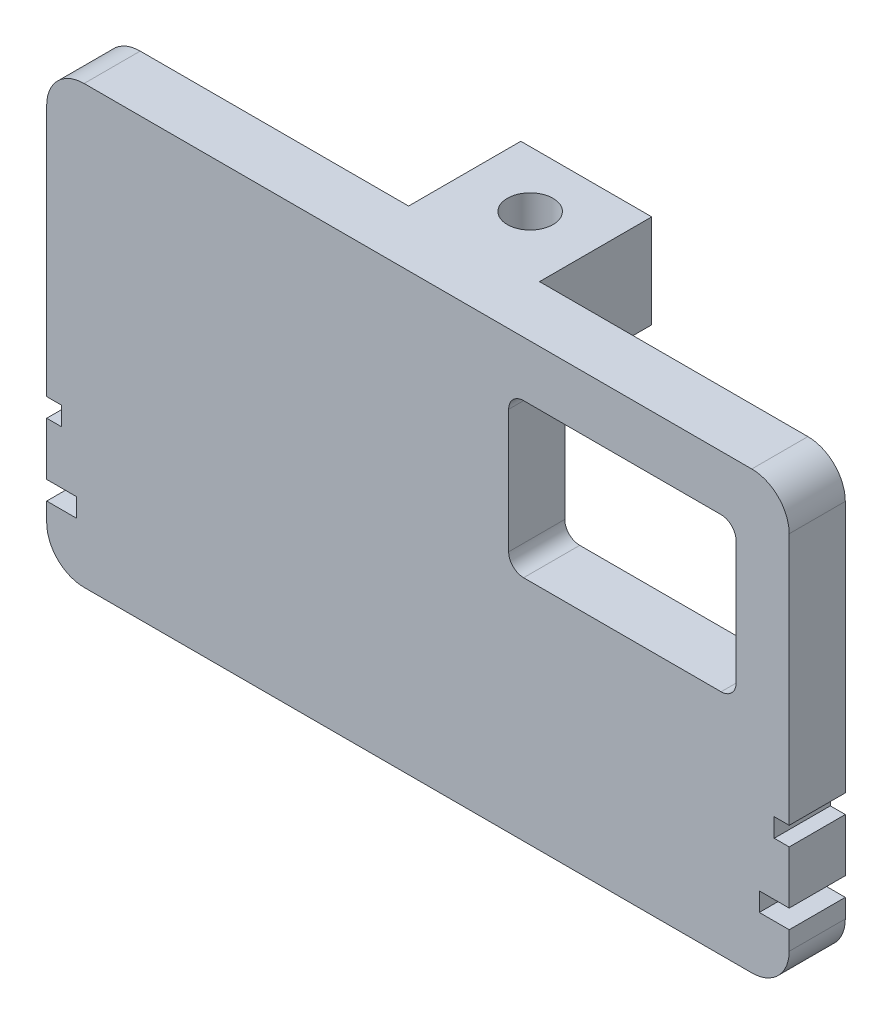
from build123d import *

# Parameters (mm, degrees)
BOSS_EXTRUDE1_DEPTH = 3.81
SKETCH2_W           = 8.89
SKETCH2_H           = 6.35
BOSS_EXTRUDE2_DEPTH = 7.62
CUT_EXTRUDE1_DEPTH  = 7.62
SKETCH4_W           = 6
SKETCH4_H           = 1.674510172
SKETCH4_H_2         = 0.925489708
CUT_EXTRUDE2_DEPTH  = 7.62


with BuildPart() as part:
    # Sketch1 → Boss-Extrude1 (new body)
    with BuildSketch(Plane.XY):
        with BuildLine():
            Line((37.128754647, 0.913367565), (37.128754647, 2.183367565))
            Line((37.128754647, 2.183367565), (35.096754647, 2.183367565))
            Line((35.096754647, 2.183367565), (35.096754647, 3.453367565))
            Line((35.096754647, 3.453367565), (37.128754647, 3.453367565))
            Line((37.128754647, 3.453367565), (37.128754647, 7.053367565))
            Line((37.128754647, 7.053367565), (36.112754647, 7.053367565))
            Line((36.112754647, 7.053367565), (36.112754647, 8.323367565))
            Line((36.112754647, 8.323367565), (37.128754647, 8.323367565))
            Line((37.128754647, 8.323367565), (37.128754647, 25.468367565))
            ThreePointArc((37.128754647, 25.468367565), (36.384805872, 27.264418789), (34.588754647, 28.008367565))
            Line((34.588754647, 28.008367565), (-10.750245353, 28.008367565))
            ThreePointArc((-10.750245353, 28.008367565), (-12.546296577, 27.264418789), (-13.290245353, 25.468367565))
            Line((-13.290245353, 25.468367565), (-13.290245353, 8.323367565))
            Line((-13.290245353, 8.323367565), (-12.274245353, 8.323367565))
            Line((-12.274245353, 8.323367565), (-12.274245353, 7.053367565))
            Line((-12.274245353, 7.053367565), (-13.290245353, 7.053367565))
            Line((-13.290245353, 7.053367565), (-13.290245353, 3.453367565))
            Line((-13.290245353, 3.453367565), (-11.258245353, 3.453367565))
            Line((-11.258245353, 3.453367565), (-11.258245353, 2.183367565))
            Line((-11.258245353, 2.183367565), (-13.290245353, 2.183367565))
            Line((-13.290245353, 2.183367565), (-13.290245353, 0.913367565))
            ThreePointArc((-13.290245353, 0.913367565), (-12.546296577, -0.882683659), (-10.750245353, -1.626632435))
            Line((-10.750245353, -1.626632435), (34.588754647, -1.626632435))
            ThreePointArc((34.588754647, -1.626632435), (36.384805872, -0.882683659), (37.128754647, 0.913367565))
        make_face()
        with BuildLine():
            Line((32.505954647, 24.279567565), (19.094754647, 24.279567565))
            ThreePointArc((19.094754647, 24.279567565), (18.376334158, 23.981988055), (18.078754647, 23.263567565))
            Line((18.078754647, 23.263567565), (18.078754647, 14.881567565))
            ThreePointArc((18.078754647, 14.881567565), (18.376334158, 14.163147076), (19.094754647, 13.865567565))
            Line((19.094754647, 13.865567565), (32.505954647, 13.865567565))
            ThreePointArc((32.505954647, 13.865567565), (33.224375137, 14.163147076), (33.521954647, 14.881567565))
            Line((33.521954647, 14.881567565), (33.521954647, 23.263567565))
            ThreePointArc((33.521954647, 23.263567565), (33.224375137, 23.981988055), (32.505954647, 24.279567565))
        make_face(mode=Mode.SUBTRACT)
    extrude(amount=-BOSS_EXTRUDE1_DEPTH)

    # Sketch2 → Boss-Extrude2 (add)
    with BuildSketch(Plane(origin=(0, 0, -3.81), x_dir=(-1, 0, 0), z_dir=(0, 0, -1))):
        with Locations((-11.919254647, 24.833367565)):
            Rectangle(SKETCH2_W, SKETCH2_H)
    extrude(amount=BOSS_EXTRUDE2_DEPTH)

    # Sketch3 → Cut-Extrude1 (cut)
    with BuildSketch(Plane(origin=(0, 28.008367565, 0), x_dir=(1, 0, 0), z_dir=(0, 1, 0))):
        with BuildLine():
            ThreePointArc((13.096102381, 8.628726629), (10.910528019, 8.796847734), (10.742406914, 6.611273371))
            Line((10.742406914, 6.611273371), (13.096102381, 8.628726629))
        make_face()
        with BuildLine():
            Line((13.096102381, 8.628726629), (10.742406914, 6.611273371))
            ThreePointArc((10.742406914, 6.611273371), (12.457021331, 6.166278227), (13.469254647, 7.62))
            ThreePointArc((13.469254647, 7.62), (13.372976421, 8.157766684), (13.096102381, 8.628726629))
        make_face()
    extrude(amount=-CUT_EXTRUDE1_DEPTH, mode=Mode.SUBTRACT)

    # Sketch4 → Cut-Extrude2 (cut)
    with BuildSketch(Plane(origin=(0, 0, -11.43), x_dir=(-1, 0, 0), z_dir=(0, 0, -1))):
        with Locations((-11.919254647, 23.996112479)):
            Rectangle(SKETCH4_W, SKETCH4_H)
        with Locations((-11.919254647, 25.296112419)):
            Rectangle(SKETCH4_W, SKETCH4_H_2)
    extrude(amount=-CUT_EXTRUDE2_DEPTH, mode=Mode.SUBTRACT)


solid = part.part
